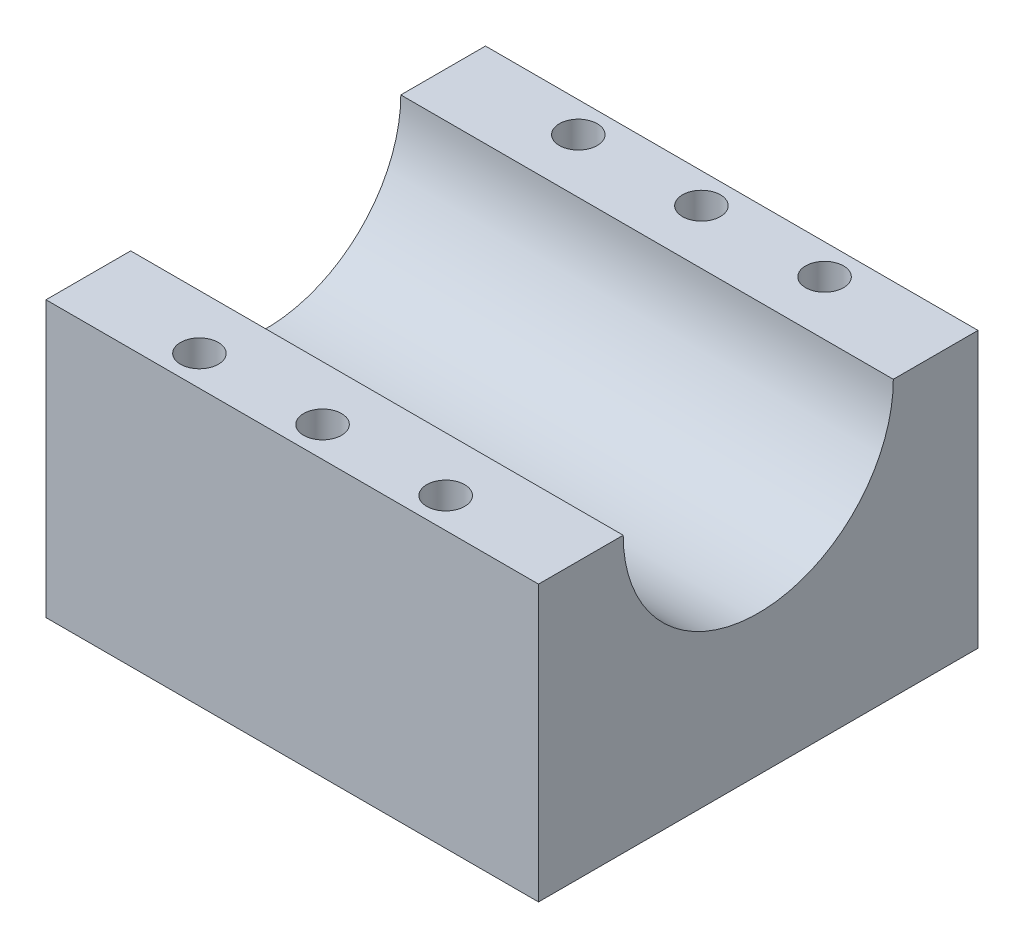
from build123d import *

# Parameters (mm, degrees)
SKETCH1_W           = 65
SKETCH1_H           = 58
SKETCH1_R           = 2.5
BOSS_EXTRUDE1_DEPTH = 36.33
SKETCH2_R           = 17.825
CUT_EXTRUDE1_DEPTH  = 80.911631819


with BuildPart() as part:
    # Sketch1 → Boss-Extrude1 (new body)
    with BuildSketch(Plane(origin=(0, 0, 0), x_dir=(1, 0, 0), z_dir=(0, 1, 0))):
        Rectangle(SKETCH1_W, SKETCH1_H)
        with Locations(Location((-16.25, 25, 0), (0, 0, 270))):
            Circle(SKETCH1_R, mode=Mode.SUBTRACT)
        with Locations(Location((16.25, 25, 0), (0, 0, 270))):
            Circle(SKETCH1_R, mode=Mode.SUBTRACT)
        with Locations(Location((16.25, -25, 0), (0, 0, 90))):
            Circle(SKETCH1_R, mode=Mode.SUBTRACT)
        with Locations(Location((-16.25, -25, 0), (0, 0, 90))):
            Circle(SKETCH1_R, mode=Mode.SUBTRACT)
        with Locations(Location((0, 25, 0), (0, 0, 270))):
            Circle(SKETCH1_R, mode=Mode.SUBTRACT)
        with Locations(Location((0, -25, 0), (0, 0, 270))):
            Circle(SKETCH1_R, mode=Mode.SUBTRACT)
    extrude(amount=BOSS_EXTRUDE1_DEPTH)

    # Sketch2 → Cut-Extrude1 (cut, through all)
    with BuildSketch(Plane(origin=(32.5, 0, 0), x_dir=(0, 0, -1), z_dir=(1, 0, 0))):
        with Locations((0, 36.33)):
            Circle(SKETCH2_R)
    extrude(amount=-CUT_EXTRUDE1_DEPTH, mode=Mode.SUBTRACT)


solid = part.part
